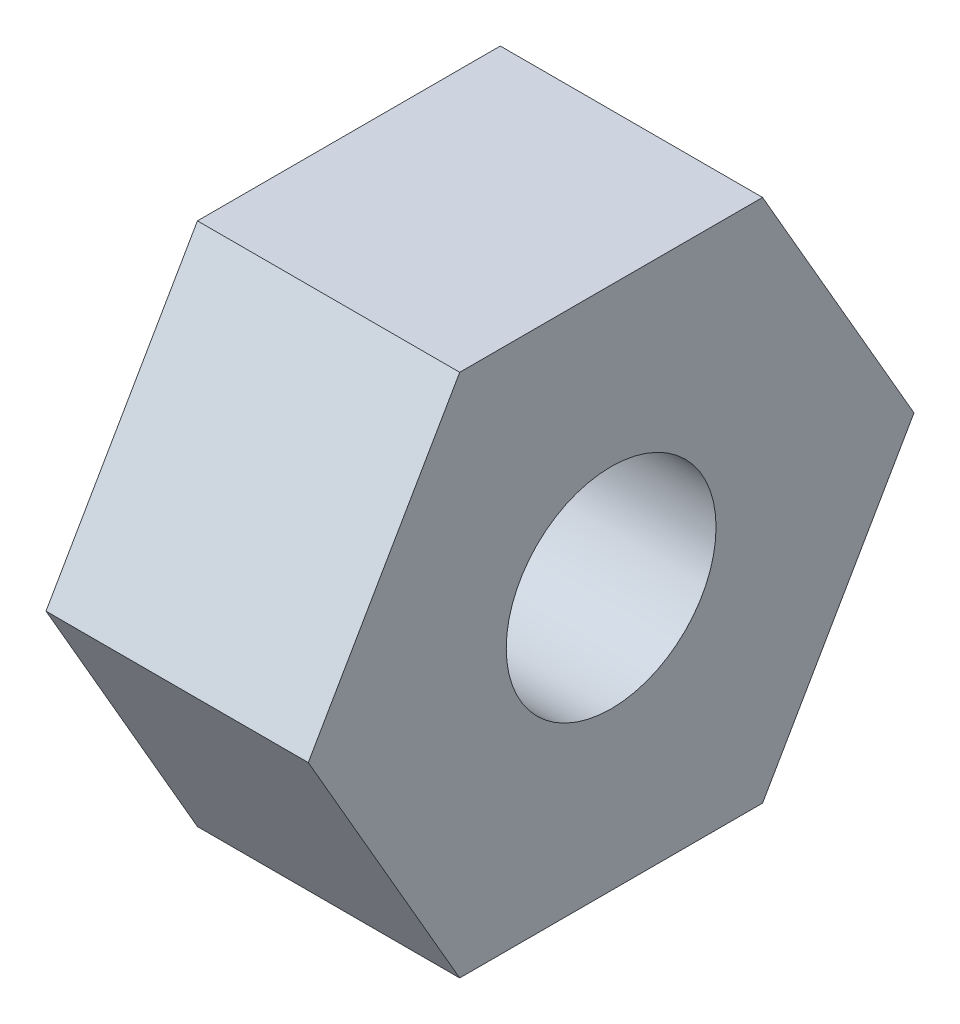
from build123d import *

# Parameters (mm, degrees)
BOSS_EXTRUDE1_DEPTH = 5
SKETCH4_R           = 2
CUT_EXTRUDE1_DEPTH  = 10.128709292


with BuildPart() as part:
    # Sketch1 → Boss-Extrude1 (new body)
    with BuildSketch(Plane(origin=(0, 0, 0), x_dir=(0, 0, -1), z_dir=(1, 0, 0))):
        Polygon((5.773502692, 0), (2.886751346, 5), (-2.886751346, 5), (-5.773502692, 0), (-2.886751346, -5), (2.886751346, -5), align=None)
    extrude(amount=BOSS_EXTRUDE1_DEPTH)

    # Sketch4 → Cut-Extrude1 (cut, through all)
    with BuildSketch(Plane.ZY):
        Circle(SKETCH4_R)
    extrude(amount=-CUT_EXTRUDE1_DEPTH, mode=Mode.SUBTRACT)


solid = part.part
